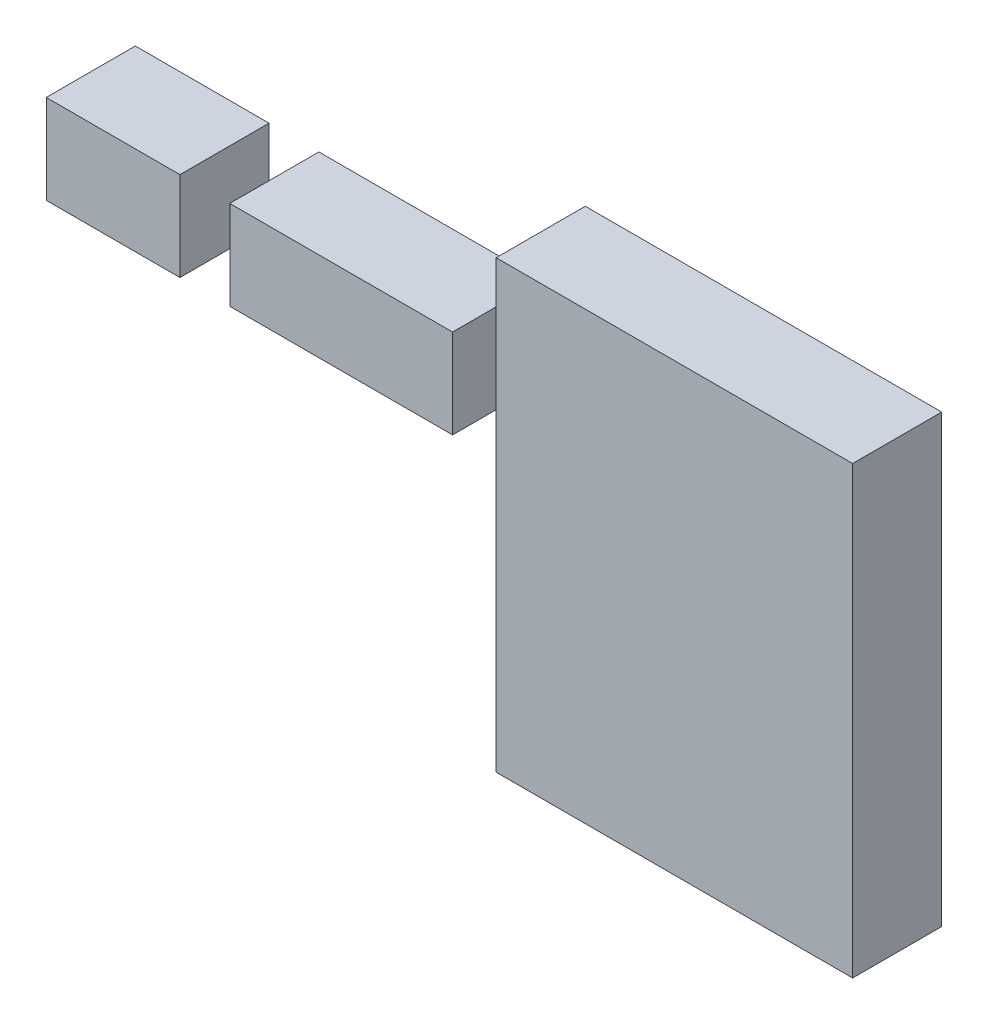
from build123d import *

# Parameters (mm, degrees)
SKETCH1_W             = 8
SKETCH1_H             = 10
BOSS_EXTRUDE1_DEPTH   = 2
SKETCH1_W_2           = 5
SKETCH1_H_2           = 2
BOSS_EXTRUDE1_2_DEPTH = 2
SKETCH1_W_3           = 3
BOSS_EXTRUDE1_3_DEPTH = 2


with BuildPart() as part:
    # Sketch1 → Boss-Extrude1 (new body)
    with BuildSketch(Plane.XY):
        with Locations((-4, 5)):
            Rectangle(SKETCH1_W, SKETCH1_H)
    extrude(amount=BOSS_EXTRUDE1_DEPTH)


with BuildPart() as body_2:
    # Sketch1 → Boss-Extrude1 2 (new body)
    with BuildSketch(Plane.XY):
        with Locations((-11.478935941, 7.065830111)):
            Rectangle(SKETCH1_W_2, SKETCH1_H_2)
    extrude(amount=BOSS_EXTRUDE1_2_DEPTH)


with BuildPart() as body_3:
    # Sketch1 → Boss-Extrude1 3 (new body)
    with BuildSketch(Plane.XY):
        with Locations((-16.597740179, 7.065830111)):
            Rectangle(SKETCH1_W_3, SKETCH1_H_2)
    extrude(amount=BOSS_EXTRUDE1_3_DEPTH)


solid = Compound([part.part, body_2.part, body_3.part])
